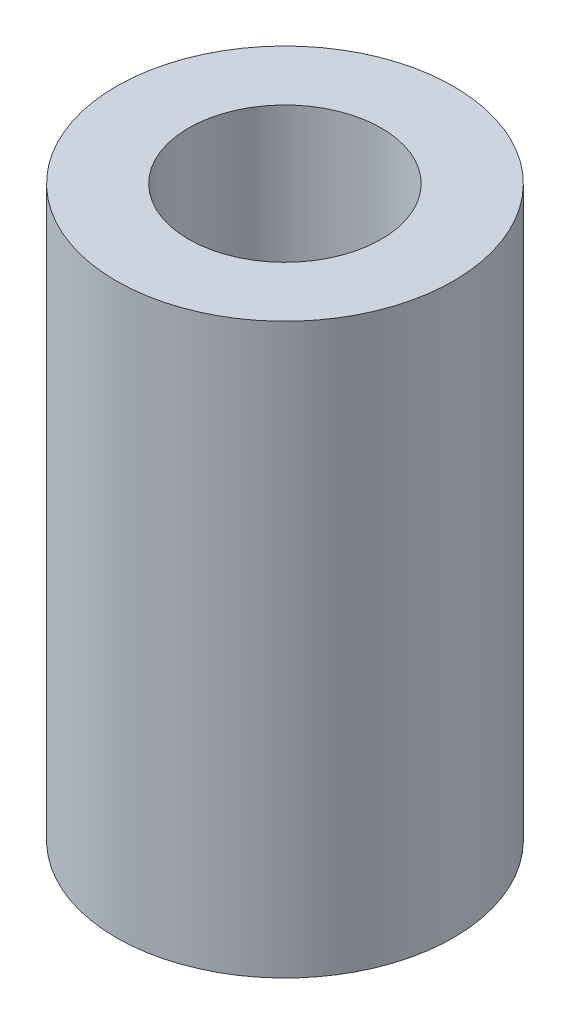
from build123d import *

# Parameters (mm, degrees)
SKETCH2_R           = 5.335
SKETCH2_R_2         = 3.05
BOSS_EXTRUDE1_DEPTH = 18


with BuildPart() as part:
    # Sketch2 → Boss-Extrude1 (new body)
    with BuildSketch(Plane(origin=(0, 0, 0), x_dir=(1, 0, 0), z_dir=(0, 1, 0))):
        with Locations(Location((0, 0, 0), (0, 0, 270))):
            Circle(SKETCH2_R)
        with Locations(Location((0, 0, 0), (0, 0, 270))):
            Circle(SKETCH2_R_2, mode=Mode.SUBTRACT)
    extrude(amount=BOSS_EXTRUDE1_DEPTH)


solid = part.part
